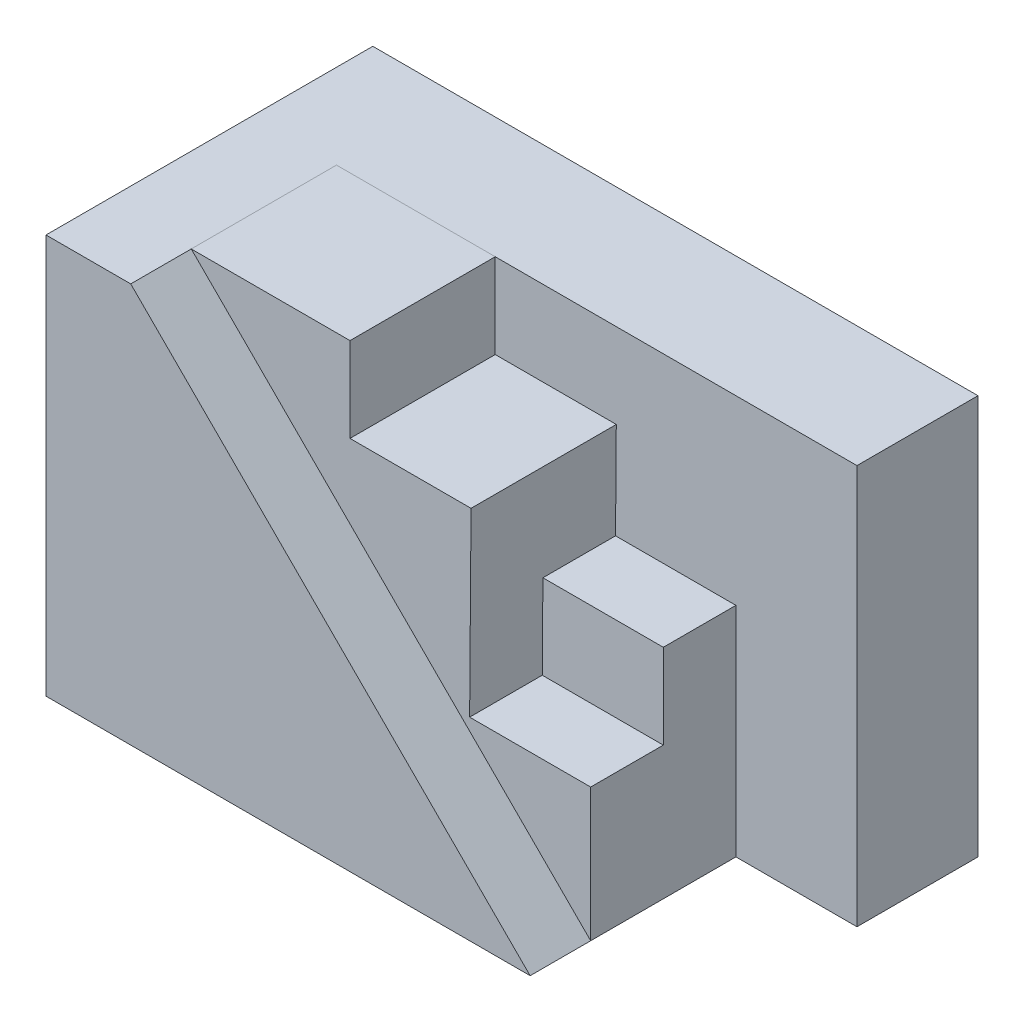
from build123d import *

# Parameters (mm, degrees)
EXTRUDE_1_DEPTH = 17
EXTRUDE_2_DEPTH = 12
SKETCH_3_W      = 6
SKETCH_3_H      = 7
EXTRUDE_3_DEPTH = 12
SKETCH_4_W      = 10
SKETCH_4_H      = 33
EXTRUDE_4_DEPTH = 40
SKETCH_10_W     = 10
SKETCH_10_H     = 33
EXTRUDE_5_DEPTH = 10


with BuildPart() as part:
    # 草圖2 → 填料-伸長1 (new body)
    with BuildSketch(Plane.XY):
        Polygon((-19.204371621, 15.843606587), (-19.204371621, -17.156393413), (20.795628379, -17.156393413), (-12.204371621, 15.843606587), align=None)
    extrude(amount=EXTRUDE_1_DEPTH)

    # 草圖2<3> → 填料-伸長2 (add)
    with BuildSketch(Plane.XY):
        Polygon((0.911243772, 15.844973174), (-12.204371621, 15.843606587), (20.795628379, -17.156393413), (20.795628379, -6.156393413), (10.795628379, -6.156393413), (10.853436076, 1.344289881), (10.911243772, 8.844973174), (0.911243772, 8.844973174), align=None)
    extrude(amount=EXTRUDE_2_DEPTH)

    # 草圖3 → 填料-伸長3 (add)
    with BuildSketch(Plane(origin=(20.795628379, 0, 0), x_dir=(0, 0, -1), z_dir=(1, 0, 0))):
        with Locations((-3, -2.656393413)):
            Rectangle(SKETCH_3_W, SKETCH_3_H)
    extrude(amount=-EXTRUDE_3_DEPTH)



with BuildPart() as body_2:
    # 草圖4 → 填料-伸長4 (new body)
    with BuildSketch(Plane(origin=(20.795628379, 0, 0), x_dir=(0, 0, -1), z_dir=(1, 0, 0))):
        with Locations((5, -0.656393413)):
            Rectangle(SKETCH_4_W, SKETCH_4_H)
    extrude(amount=-EXTRUDE_4_DEPTH)


with BuildPart() as part_1:
    add(part.part)

    add(body_2.part)  # 填料-伸長5 merges body 2
    # 草圖10 → 填料-伸長5 (add)
    with BuildSketch(Plane(origin=(20.795628379, 0, 0), x_dir=(0, 0, -1), z_dir=(1, 0, 0))):
        with Locations((5, -0.656393413)):
            Rectangle(SKETCH_10_W, SKETCH_10_H)
    extrude(amount=EXTRUDE_5_DEPTH)


solid = part_1.part
